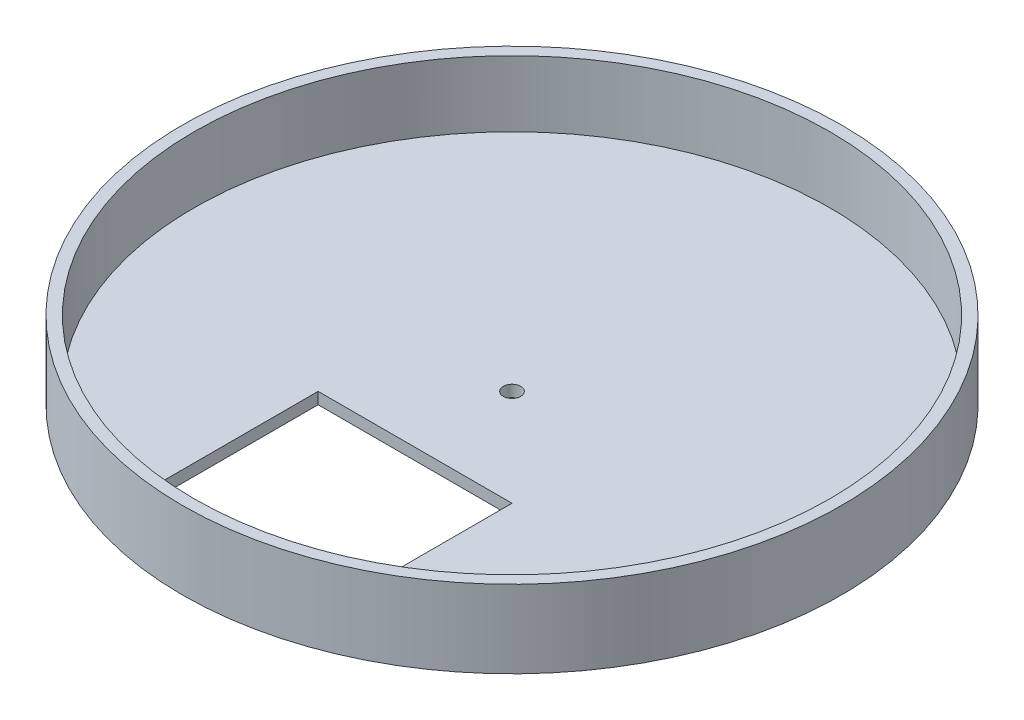
from build123d import *
from build123d.topology import SkipClean

# Parameters (mm, degrees)
SKETCH1_R           = 215.9
BOSS_EXTRUDE1_DEPTH = 50.8
SKETCH2_R           = 208.28
CUT_EXTRUDE1_DEPTH  = 43.18
CUT_EXTRUDE2_DEPTH  = 309.366879544
SKETCH4_R           = 5.715
CUT_EXTRUDE3_DEPTH  = 309.366879544


with BuildPart() as part:
    # Sketch1 → Boss-Extrude1 (new body)
    with BuildSketch(Plane(origin=(0, 0, 0), x_dir=(1, 0, 0), z_dir=(0, 1, 0))):
        with Locations(Location((0, 0, 0), (0, 0, 270))):
            Circle(SKETCH1_R)
    extrude(amount=BOSS_EXTRUDE1_DEPTH)

    # Sketch2 → Cut-Extrude1 (cut)
    with BuildSketch(Plane(origin=(0, 50.8, 0), x_dir=(1, 0, 0), z_dir=(0, 1, 0))):
        with Locations(Location((0, 0, 0), (0, 0, 270))):
            Circle(SKETCH2_R)
    extrude(amount=-CUT_EXTRUDE1_DEPTH, mode=Mode.SUBTRACT)

    # Sketch3 → Cut-Extrude2 (cut, through all)
    with SkipClean():  # the faces are left unmerged after this step: merging them gives an invalid solid
        with BuildSketch(Plane(origin=(0, 7.62, 0), x_dir=(1, 0, 0), z_dir=(0, 1, 0))):
            with BuildLine():
                Line((-63.5, -63.5), (63.5, -63.5))
                Line((63.5, -63.5), (63.5, -198.364080418))
                ThreePointArc((63.5, -198.364080418), (0, -208.28), (-63.5, -198.364080418))
                Line((-63.5, -198.364080418), (-63.5, -63.5))
            make_face()
        extrude(amount=-CUT_EXTRUDE2_DEPTH, mode=Mode.SUBTRACT)

    # Sketch4 → Cut-Extrude3 (cut, through all)
    with SkipClean():  # the faces are left unmerged after this step: merging them gives an invalid solid
        with BuildSketch(Plane(origin=(0, 7.62, 0), x_dir=(1, 0, 0), z_dir=(0, 1, 0))):
            with Locations(Location((0, 0, 0), (0, 0, 270))):
                Circle(SKETCH4_R)
        extrude(amount=-CUT_EXTRUDE3_DEPTH, mode=Mode.SUBTRACT)


solid = part.part
